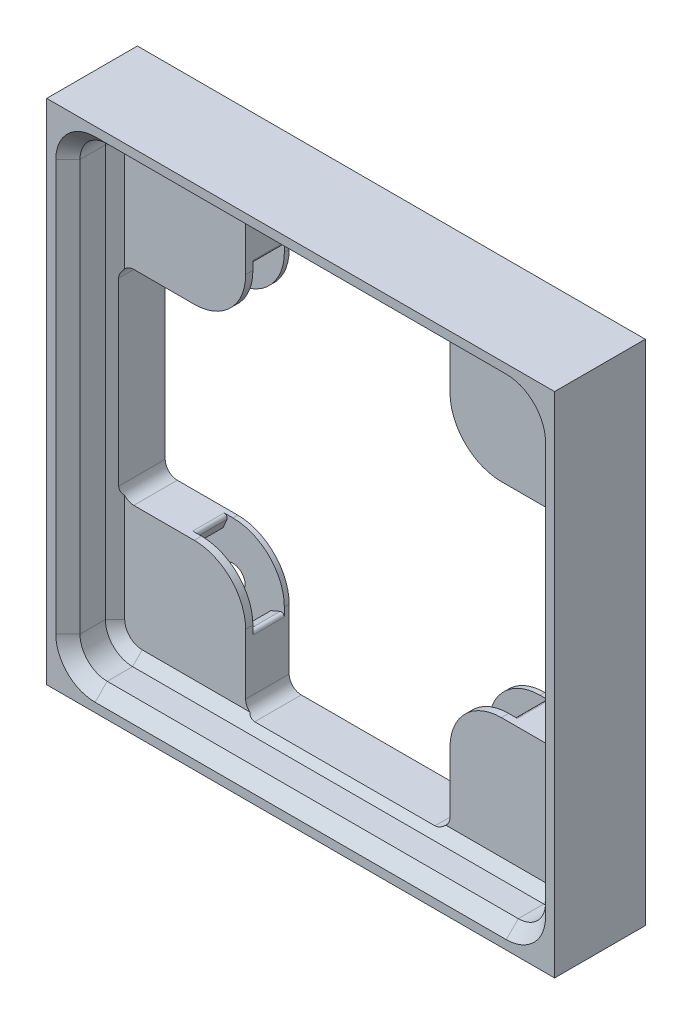
from build123d import *

# Parameters (mm, degrees)
MAGNET_SLOT_DEPTH   = 2.6
MAGNET_TOPPER_DEPTH = 0.6
BOTTOM_START        = 0.4
BOTTOM_DEPTH        = 0.4
CUT_EXTRUDE1_REACH  = 31.916
FILLET1_R           = 1
BOSS_EXTRUDE1_DEPTH = 3.9
CHAMFER1_SIZE       = 0.8
CHAMFER2_SIZE       = 1
CIRPATTERN1_COUNT   = 4


with BuildPart() as part:
    # Sketch1 → Magnet Slot (new body)
    with BuildSketch(Plane.XY):
        with BuildLine():
            Line((-21, 0), (-18.7, 0))
            Line((-18.7, 0), (-18.7, 8.45))
            Line((-18.7, 8.45), (-13.423469406, 8.45))
            ThreePointArc((-13.423469406, 8.45), (-13.215070921, 8.56190557), (-13.193240046, 8.797439428))
            Line((-13.193240046, 8.797439428), (-13.513172798, 9.553374824))
            ThreePointArc((-13.513172798, 9.553374824), (-14.998097039, 14.998097039), (-9.553374824, 13.513172798))
            Line((-9.553374824, 13.513172798), (-8.797439428, 13.193240046))
            ThreePointArc((-8.797439428, 13.193240046), (-8.56190557, 13.215070921), (-8.45, 13.423469406))
            Line((-8.45, 13.423469406), (-8.45, 18.7))
            Line((-8.45, 18.7), (0, 18.7))
            Line((0, 18.7), (0, 21))
            Line((0, 21), (-21, 21))
            Line((-21, 21), (-21, 0))
        make_face()
    extrude(amount=MAGNET_SLOT_DEPTH)

    # Sketch2 → Magnet Topper (add)
    with BuildSketch(Plane.XY.offset(2.6)):
        with BuildLine():
            Line((-12.7, 8.45), (-18.7, 8.45))
            Line((-18.7, 8.45), (-18.7, 0))
            Line((-18.7, 0), (-21, 0))
            Line((-21, 0), (-21, 21))
            Line((-21, 21), (0, 21))
            Line((0, 21), (0, 18.7))
            Line((0, 18.7), (-8.45, 18.7))
            Line((-8.45, 18.7), (-8.45, 12.7))
            ThreePointArc((-8.45, 12.7), (-9.69479618, 9.69479618), (-12.7, 8.45))
        make_face()
    extrude(amount=MAGNET_TOPPER_DEPTH)

    # Sketch3 → Bottom (add)
    with BuildSketch(Plane(origin=(0, 0, 0), x_dir=(-1, 0, 0), z_dir=(0, 0, -1)).offset(BOTTOM_START)):
        with BuildLine():
            Line((18.7, 8.45), (18.7, 0))
            Line((18.7, 0), (21, 0))
            Line((21, 0), (21, 21))
            Line((21, 21), (0, 21))
            Line((0, 21), (0, 18.7))
            Line((0, 18.7), (8.45, 18.7))
            Line((8.45, 18.7), (8.45, 12.7))
            ThreePointArc((8.45, 12.7), (9.69479618, 9.69479618), (12.7, 8.45))
            Line((12.7, 8.45), (18.7, 8.45))
        make_face()
    extrude(amount=-BOTTOM_DEPTH)

    # Cut-Extrude1: up to this face of the body (flat: up to its plane)
    cut_extrude1_end = Plane(part.part.faces().sort_by_distance((-12.297393308, 12.297393308, 2.6))[0])
    # Sketch4 → Cut-Extrude1 (cut, up to the picked face)
    with BuildSketch(Plane(origin=(0, 0, -0.4), x_dir=(-1, 0, 0), z_dir=(0, 0, -1)), mode=Mode.PRIVATE) as cut_extrude1_sk1:
        with BuildLine():
            Line((11.992893219, 13.407106781), (15.528427125, 16.942640687))
            ThreePointArc((15.528427125, 16.942640687), (16.942640687, 16.942640687), (16.942640687, 15.528427125))
            Line((16.942640687, 15.528427125), (13.407106781, 11.992893219))
            ThreePointArc((13.407106781, 11.992893219), (11.992893219, 11.992893219), (11.992893219, 13.407106781))
        make_face()
    cut_extrude1_tool1 = split(extrude(cut_extrude1_sk1.sketch, amount=-CUT_EXTRUDE1_REACH, mode=Mode.PRIVATE), bisect_by=cut_extrude1_end, keep=Keep.BOTH, mode=Mode.PRIVATE)
    add(cut_extrude1_tool1.solids().sort_by(Axis((-14.467767, 14.467767, -0.4), (0, 0, 1)))[0], mode=Mode.SUBTRACT)

    # Fillet1
    fillet1_edges = [part.edges().sort_by_distance(p)[0] for p in [
        (-8.45, 18.7, 1.4),
        (-18.7, 8.45, 1.4),
    ]]
    fillet(fillet1_edges, radius=FILLET1_R)

    # Sketch5 → Boss-Extrude1 (add)
    with BuildSketch(Plane.XY.offset(3.2)):
        with BuildLine():
            Line((0, 21), (-17.25, 21))
            Line((-17.25, 21), (-21, 21))
            Line((-21, 21), (-21, 17.25))
            Line((-21, 17.25), (-21, 0))
            Line((-21, 0), (-19.25, 0))
            Line((-19.25, 0), (-19.25, 17))
            ThreePointArc((-19.25, 17), (-18.590990258, 18.590990258), (-17, 19.25))
            Line((-17, 19.25), (0, 19.25))
            Line((0, 19.25), (0, 21))
        make_face()
    extrude(amount=BOSS_EXTRUDE1_DEPTH)

    # Chamfer1
    chamfer1_edges = [part.edges().sort_by_distance(p)[0] for p in [
        (-19.25, 8.5, 3.2),
        (-18.590990258, 18.590990258, 3.2),
        (-8.5, 19.25, 3.2),
    ]]
    chamfer(chamfer1_edges, length=CHAMFER1_SIZE)

    # Chamfer2
    chamfer2_edges = [part.edges().sort_by_distance(p)[0] for p in [
        (-19.25, 8.5, 7.1),
        (-18.590990258, 18.590990258, 7.1),
        (-8.5, 19.25, 7.1),
    ]]
    chamfer(chamfer2_edges, length=CHAMFER2_SIZE)


with BuildPart() as cirpattern1_1:
    # CirPattern1: pattern copy
    add(part.part.rotate(Axis((0, 0, 0), (0, 0, 1)), 1 * 360 / CIRPATTERN1_COUNT))


with BuildPart() as cirpattern1_2:
    # CirPattern1: pattern copy
    add(part.part.rotate(Axis((0, 0, 0), (0, 0, 1)), 2 * 360 / CIRPATTERN1_COUNT))


with BuildPart() as cirpattern1_3:
    # CirPattern1: pattern copy
    add(part.part.rotate(Axis((0, 0, 0), (0, 0, 1)), 3 * 360 / CIRPATTERN1_COUNT))


with BuildPart() as part_1:
    add(part.part)

    # Combine1: union CirPattern1_3, CirPattern1_1, CirPattern1_2
    add(cirpattern1_3.part)
    add(cirpattern1_1.part)
    add(cirpattern1_2.part)


solid = part_1.part
